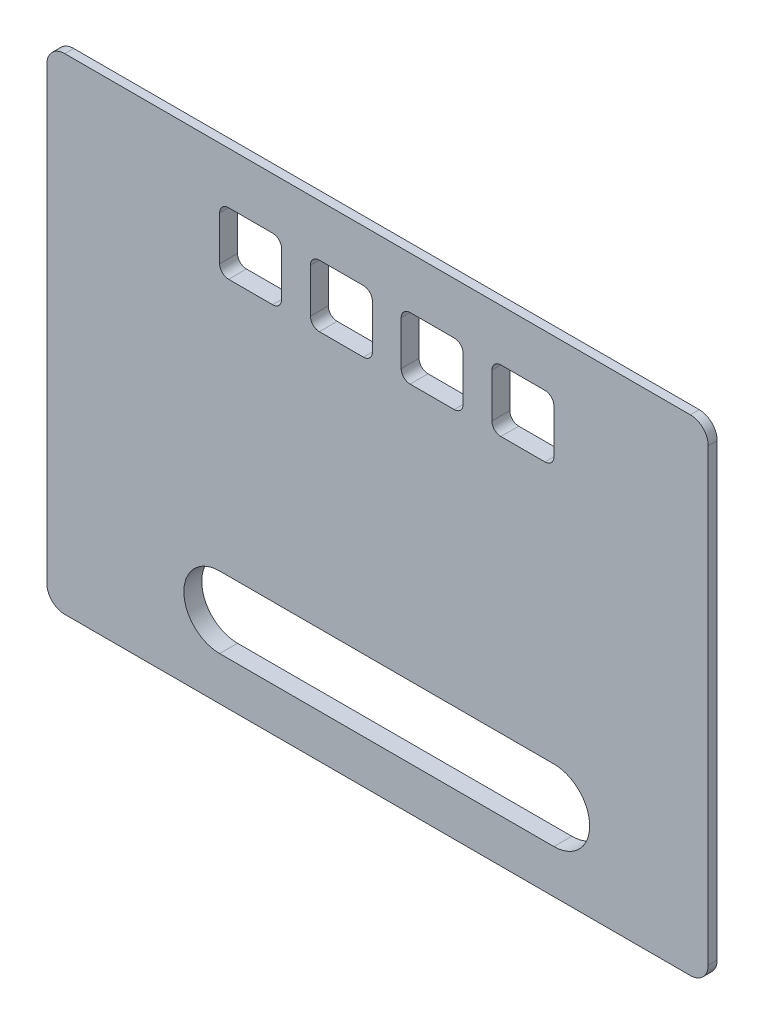
from build123d import *

# Parameters (mm, degrees)
SKETCH_1_W                                     = 105
SKETCH_1_H                                     = 74
EXTRUDE_1_DEPTH                                = 3
EXTRUDE_START                                  = 1.5
SKETCH_2_W                                     = 111
SKETCH_2_H                                     = 80
EXTRUDE_2_DEPTH                                = 1.5
SKETCH_3_W                                     = 10.4
SKETCH_3_H                                     = 10.4
CUT_EXTRUDE_1_DEPTH                            = 5
SKETCH_4_W                                     = 105
SKETCH_4_H                                     = 1.5
TOP_REAR_INNER_EXTENSION_1P5MM_DEPTH           = 3
TOP_REAR_OUTER_SKIN_EXTENSION_1P5MM_START      = 1.5
SKETCH_5_W                                     = 111
SKETCH_5_H                                     = 1.5
TOP_REAR_OUTER_SKIN_EXTENSION_1P5MM_DEPTH      = 1.5
TOOL_D3_R1P5_BUTTON_CORNERS_R                  = 1.5
TOOL_D3_R3_TOP_OUTER_CONTOUR_R                 = 3
SKETCH_6_R                                     = 1.5
TOP_PLANAR_EDGE_SEMICIRCLE_POCKETS_D3_DE_DEPTH = 1.5


with BuildPart() as part:
    # Эскиз1 → Бобышка-Вытянуть1 (new body)
    with BuildSketch(Plane.XY):
        with Locations((53.5, 40)):
            Rectangle(SKETCH_1_W, SKETCH_1_H)
    extrude(amount=EXTRUDE_1_DEPTH)

    # Эскиз2 → Бобышка-Вытянуть2 (add)
    with BuildSketch(Plane.XY.offset(EXTRUDE_START)):
        with Locations((53.5, 40)):
            Rectangle(SKETCH_2_W, SKETCH_2_H)
    extrude(amount=EXTRUDE_2_DEPTH)

    # Эскиз3 → Вырез-Вытянуть1 (cut)
    with BuildSketch(Plane(origin=(0.75, 0, 3), x_dir=(1, 0, 0), z_dir=(0, 0, 1))):
        with Locations((31.45, 67.65)):
            Rectangle(SKETCH_3_W, SKETCH_3_H)
        with Locations((46.683, 67.65)):
            Rectangle(SKETCH_3_W, SKETCH_3_H)
        with Locations((61.917, 67.65)):
            Rectangle(SKETCH_3_W, SKETCH_3_H)
        with Locations((77.15, 67.65)):
            Rectangle(SKETCH_3_W, SKETCH_3_H)
        with BuildLine():
            Line((26.25, 19.3), (82.35, 19.3))
            ThreePointArc((82.35, 19.3), (88.35, 13.3), (82.35, 7.3))
            Line((82.35, 7.3), (26.25, 7.3))
            ThreePointArc((26.25, 7.3), (20.25, 13.3), (26.25, 19.3))
        make_face()
    extrude(amount=-CUT_EXTRUDE_1_DEPTH, mode=Mode.SUBTRACT)

    # Эскиз4 → top_rear_inner_extension_1p5mm (add)
    with BuildSketch(Plane.XY):
        with Locations((53.5, 77.75)):
            Rectangle(SKETCH_4_W, SKETCH_4_H)
    extrude(amount=TOP_REAR_INNER_EXTENSION_1P5MM_DEPTH)

    # Эскиз5 → top_rear_outer_skin_extension_1p5mm (add)
    with BuildSketch(Plane.XY.offset(TOP_REAR_OUTER_SKIN_EXTENSION_1P5MM_START)):
        with Locations((53.5, 80.75)):
            Rectangle(SKETCH_5_W, SKETCH_5_H)
    extrude(amount=TOP_REAR_OUTER_SKIN_EXTENSION_1P5MM_DEPTH)

    # tool_D3_R1p5_button_corners
    tool_d3_r1p5_button_corners_edges = [part.edges().sort_by_distance(p)[0] for p in [
        (42.233, 62.45, 1.5),
        (42.233, 72.85, 1.5),
        (52.633, 72.85, 1.5),
        (52.633, 62.45, 1.5),
        (57.467, 62.45, 1.5),
        (57.467, 72.85, 1.5),
        (67.867, 72.85, 1.5),
        (67.867, 62.45, 1.5),
        (72.7, 62.45, 1.5),
        (72.7, 72.85, 1.5),
        (83.1, 72.85, 1.5),
        (83.1, 62.45, 1.5),
        (27, 62.45, 1.5),
        (27, 72.85, 1.5),
        (37.4, 72.85, 1.5),
        (37.4, 62.45, 1.5),
    ]]
    fillet(tool_d3_r1p5_button_corners_edges, radius=TOOL_D3_R1P5_BUTTON_CORNERS_R)

    # tool_D3_R3_top_outer_contour
    tool_d3_r3_top_outer_contour_edges = [part.edges().sort_by_distance(p)[0] for p in [
        (-2, 81.5, 2.25),
        (109, 81.5, 2.25),
        (-2, 0, 2.25),
        (109, 0, 2.25),
    ]]
    fillet(tool_d3_r3_top_outer_contour_edges, radius=TOOL_D3_R3_TOP_OUTER_CONTOUR_R)

    # Эскиз6 → top_planar_edge_semicircle_pockets_D3_depth1p5_6x (cut)
    with BuildSketch(Plane(origin=(0, 0, 0), x_dir=(-1, 0, 0), z_dir=(0, 0, -1))):
        with Locations((-1, 10)):
            Circle(SKETCH_6_R)
        with Locations((-106, 10)):
            Circle(SKETCH_6_R)
        with Locations((-1, 40.75)):
            Circle(SKETCH_6_R)
        with Locations((-106, 40.75)):
            Circle(SKETCH_6_R)
        with Locations((-1, 71.5)):
            Circle(SKETCH_6_R)
        with Locations((-106, 71.5)):
            Circle(SKETCH_6_R)
    extrude(amount=-TOP_PLANAR_EDGE_SEMICIRCLE_POCKETS_D3_DE_DEPTH, mode=Mode.SUBTRACT)


solid = part.part
